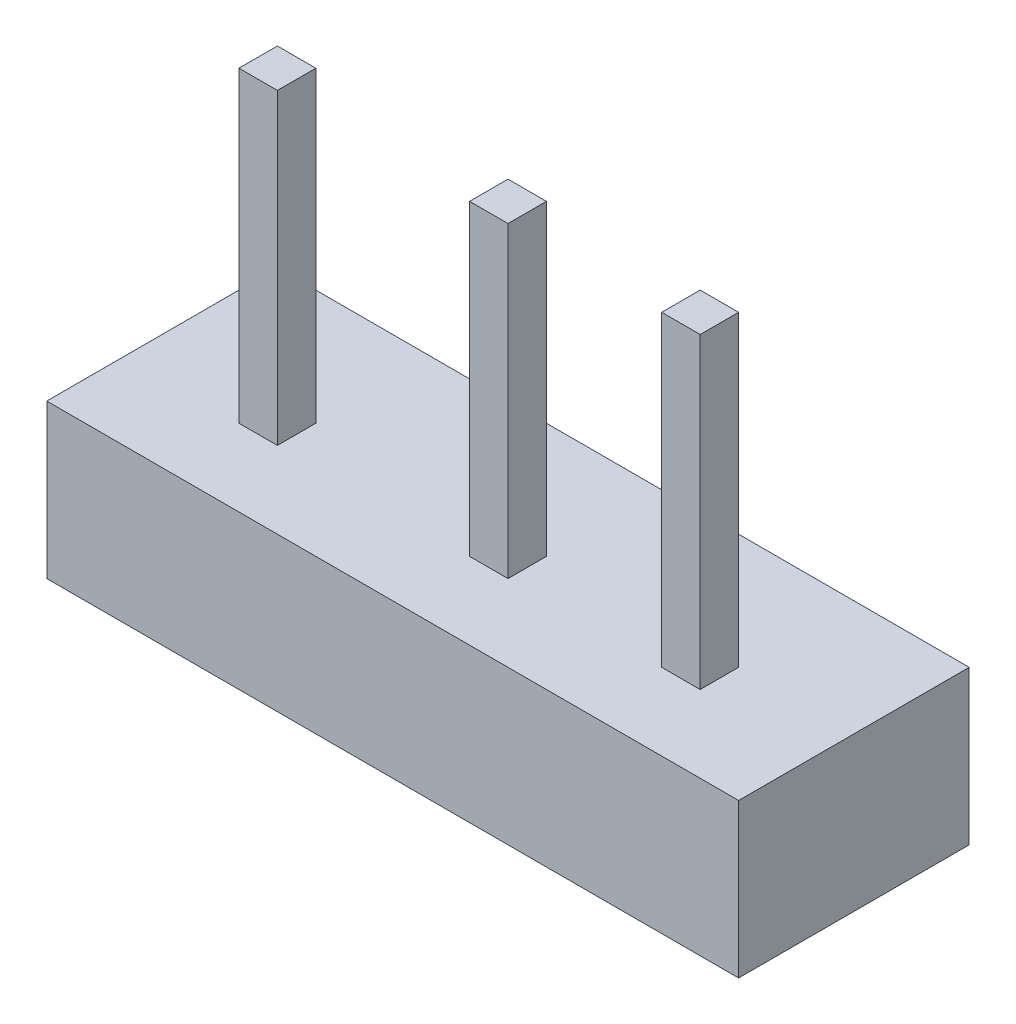
from build123d import *

# Parameters (mm, degrees)
SKETCH1_W           = 9
SKETCH1_H           = 3
BOSS_EXTRUDE2_DEPTH = 2
SKETCH2_W           = 0.5
SKETCH2_H           = 0.5
BOSS_EXTRUDE3_DEPTH = 4


with BuildPart() as part:
    # Sketch1 → Boss-Extrude2 (new body)
    with BuildSketch(Plane(origin=(0, 0, 0), x_dir=(1, 0, 0), z_dir=(0, 1, 0))):
        with Locations((4.5, 1.5)):
            Rectangle(SKETCH1_W, SKETCH1_H)
    extrude(amount=BOSS_EXTRUDE2_DEPTH)

    # Sketch2 → Boss-Extrude3 (add)
    with BuildSketch(Plane(origin=(0, 2, 0), x_dir=(1, 0, 0), z_dir=(0, 1, 0))):
        with Locations((7.25, 1.25)):
            Rectangle(SKETCH2_W, SKETCH2_H)
        with Locations((4.75, 1.25)):
            Rectangle(SKETCH2_W, SKETCH2_H)
        with Locations((1.75, 1.25)):
            Rectangle(SKETCH2_W, SKETCH2_H)
    extrude(amount=BOSS_EXTRUDE3_DEPTH)


solid = part.part
